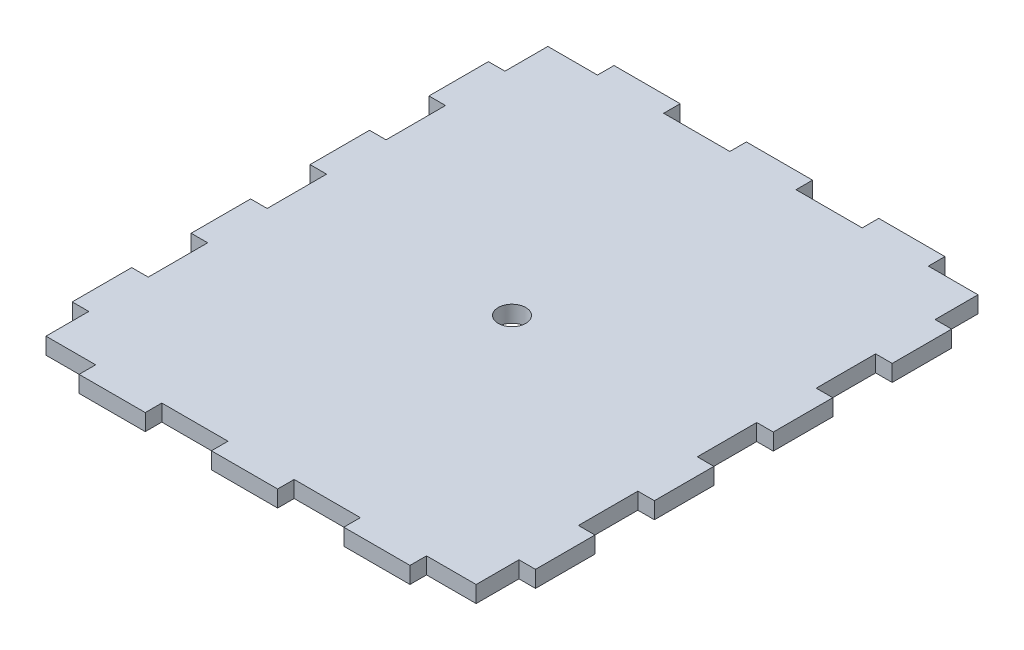
from build123d import *

# Parameters (mm, degrees)
ESBO_O1_W                = 84
ESBO_O1_H                = 97
RESSALTO_EXTRUS_O1_DEPTH = 3
ESBO_O2_W                = 3
ESBO_O2_H                = 10.777777778
CORTE_EXTRUS_O4_DEPTH    = 3
CORTE_EXTRUS_O9_REACH    = 66.228
ESBO_O5_W                = 12
ESBO_O5_H                = 3
CORTE_EXTRUS_O10_REACH   = 66.228
ESBO_O6_R                = 2.5


with BuildPart() as part:
    # Esboço1 → Ressalto-extrusão1 (new body)
    with BuildSketch(Plane(origin=(0, 0, 0), x_dir=(1, 0, 0), z_dir=(0, 1, 0))):
        Rectangle(ESBO_O1_W, ESBO_O1_H)
    extrude(amount=RESSALTO_EXTRUS_O1_DEPTH)

    # Esboço2 → Corte-extrusão4 (cut)
    with BuildSketch(Plane.XZ):
        with Locations((-40.5, -43.111111111)):
            Rectangle(ESBO_O2_W, ESBO_O2_H)
        with Locations((40.5, -43.111111111)):
            Rectangle(ESBO_O2_W, ESBO_O2_H)
        with Locations((40.5, -21.551111111)):
            Rectangle(ESBO_O2_W, ESBO_O2_H)
        with Locations((40.5, 0.008888889)):
            Rectangle(ESBO_O2_W, ESBO_O2_H)
        with Locations((40.5, 21.568888889)):
            Rectangle(ESBO_O2_W, ESBO_O2_H)
        with Locations((40.5, 43.128888889)):
            Rectangle(ESBO_O2_W, ESBO_O2_H)
        with Locations((-40.5, -21.551111111)):
            Rectangle(ESBO_O2_W, ESBO_O2_H)
        with Locations((-40.5, 0.008888889)):
            Rectangle(ESBO_O2_W, ESBO_O2_H)
        with Locations((-40.5, 21.568888889)):
            Rectangle(ESBO_O2_W, ESBO_O2_H)
        with Locations((-40.5, 43.128888889)):
            Rectangle(ESBO_O2_W, ESBO_O2_H)
    extrude(amount=-CORTE_EXTRUS_O4_DEPTH, mode=Mode.SUBTRACT)

    # Esboço5 → Corte-extrusão9 (cut, up to next)
    with BuildSketch(Plane(origin=(0, 0, 0), x_dir=(1, 0, 0), z_dir=(0, 1, 0)), mode=Mode.PRIVATE) as corte_extrus_o9_sk1:
        with Locations((-36, 47)):
            Rectangle(ESBO_O5_W, ESBO_O5_H)
    corte_extrus_o9_tool1 = extrude(corte_extrus_o9_sk1.sketch, amount=CORTE_EXTRUS_O9_REACH, mode=Mode.PRIVATE) & part.part
    # Esboço5 → Corte-extrusão9 (cut, up to next)
    with BuildSketch(Plane(origin=(0, 0, 0), x_dir=(1, 0, 0), z_dir=(0, 1, 0)), mode=Mode.PRIVATE) as corte_extrus_o9_sk2:
        with Locations((-36, -47)):
            Rectangle(ESBO_O5_W, ESBO_O5_H)
    corte_extrus_o9_tool2 = extrude(corte_extrus_o9_sk2.sketch, amount=CORTE_EXTRUS_O9_REACH, mode=Mode.PRIVATE) & part.part
    # Esboço5 → Corte-extrusão9 (cut, up to next)
    with BuildSketch(Plane(origin=(0, 0, 0), x_dir=(1, 0, 0), z_dir=(0, 1, 0)), mode=Mode.PRIVATE) as corte_extrus_o9_sk3:
        with Locations((36, -47)):
            Rectangle(ESBO_O5_W, ESBO_O5_H)
    corte_extrus_o9_tool3 = extrude(corte_extrus_o9_sk3.sketch, amount=CORTE_EXTRUS_O9_REACH, mode=Mode.PRIVATE) & part.part
    # Esboço5 → Corte-extrusão9 (cut, up to next)
    with BuildSketch(Plane(origin=(0, 0, 0), x_dir=(1, 0, 0), z_dir=(0, 1, 0)), mode=Mode.PRIVATE) as corte_extrus_o9_sk4:
        with Locations((36, 47)):
            Rectangle(ESBO_O5_W, ESBO_O5_H)
    corte_extrus_o9_tool4 = extrude(corte_extrus_o9_sk4.sketch, amount=CORTE_EXTRUS_O9_REACH, mode=Mode.PRIVATE) & part.part
    # Esboço5 → Corte-extrusão9 (cut, up to next)
    with BuildSketch(Plane(origin=(0, 0, 0), x_dir=(1, 0, 0), z_dir=(0, 1, 0)), mode=Mode.PRIVATE) as corte_extrus_o9_sk5:
        with Locations((-12, -47)):
            Rectangle(ESBO_O5_W, ESBO_O5_H)
    corte_extrus_o9_tool5 = extrude(corte_extrus_o9_sk5.sketch, amount=CORTE_EXTRUS_O9_REACH, mode=Mode.PRIVATE) & part.part
    # Esboço5 → Corte-extrusão9 (cut, up to next)
    with BuildSketch(Plane(origin=(0, 0, 0), x_dir=(1, 0, 0), z_dir=(0, 1, 0)), mode=Mode.PRIVATE) as corte_extrus_o9_sk6:
        with Locations((12, -47)):
            Rectangle(ESBO_O5_W, ESBO_O5_H)
    corte_extrus_o9_tool6 = extrude(corte_extrus_o9_sk6.sketch, amount=CORTE_EXTRUS_O9_REACH, mode=Mode.PRIVATE) & part.part
    # Esboço5 → Corte-extrusão9 (cut, up to next)
    with BuildSketch(Plane(origin=(0, 0, 0), x_dir=(1, 0, 0), z_dir=(0, 1, 0)), mode=Mode.PRIVATE) as corte_extrus_o9_sk7:
        with Locations((-12, 47)):
            Rectangle(ESBO_O5_W, ESBO_O5_H)
    corte_extrus_o9_tool7 = extrude(corte_extrus_o9_sk7.sketch, amount=CORTE_EXTRUS_O9_REACH, mode=Mode.PRIVATE) & part.part
    # Esboço5 → Corte-extrusão9 (cut, up to next)
    with BuildSketch(Plane(origin=(0, 0, 0), x_dir=(1, 0, 0), z_dir=(0, 1, 0)), mode=Mode.PRIVATE) as corte_extrus_o9_sk8:
        with Locations((12, 47)):
            Rectangle(ESBO_O5_W, ESBO_O5_H)
    corte_extrus_o9_tool8 = extrude(corte_extrus_o9_sk8.sketch, amount=CORTE_EXTRUS_O9_REACH, mode=Mode.PRIVATE) & part.part
    add(corte_extrus_o9_tool1.solids().sort_by_distance((-36, 0, -47))[0], mode=Mode.SUBTRACT)
    add(corte_extrus_o9_tool2.solids().sort_by_distance((-36, 0, 47))[0], mode=Mode.SUBTRACT)
    add(corte_extrus_o9_tool3.solids().sort_by_distance((36, 0, 47))[0], mode=Mode.SUBTRACT)
    add(corte_extrus_o9_tool4.solids().sort_by_distance((36, 0, -47))[0], mode=Mode.SUBTRACT)
    add(corte_extrus_o9_tool5.solids().sort_by_distance((-12, 0, 47))[0], mode=Mode.SUBTRACT)
    add(corte_extrus_o9_tool6.solids().sort_by_distance((12, 0, 47))[0], mode=Mode.SUBTRACT)
    add(corte_extrus_o9_tool7.solids().sort_by_distance((-12, 0, -47))[0], mode=Mode.SUBTRACT)
    add(corte_extrus_o9_tool8.solids().sort_by_distance((12, 0, -47))[0], mode=Mode.SUBTRACT)

    # Esboço6 → Corte-extrusão10 (cut, up to next)
    with BuildSketch(Plane.XZ, mode=Mode.PRIVATE) as corte_extrus_o10_sk1:
        with Locations(Location((0, 0, 0), (0, 0, 270))):
            Circle(ESBO_O6_R)
    corte_extrus_o10_tool1 = extrude(corte_extrus_o10_sk1.sketch, amount=-CORTE_EXTRUS_O10_REACH, mode=Mode.PRIVATE) & part.part
    add(corte_extrus_o10_tool1.solids().sort_by_distance((0, 0, 0))[0], mode=Mode.SUBTRACT)


solid = part.part
